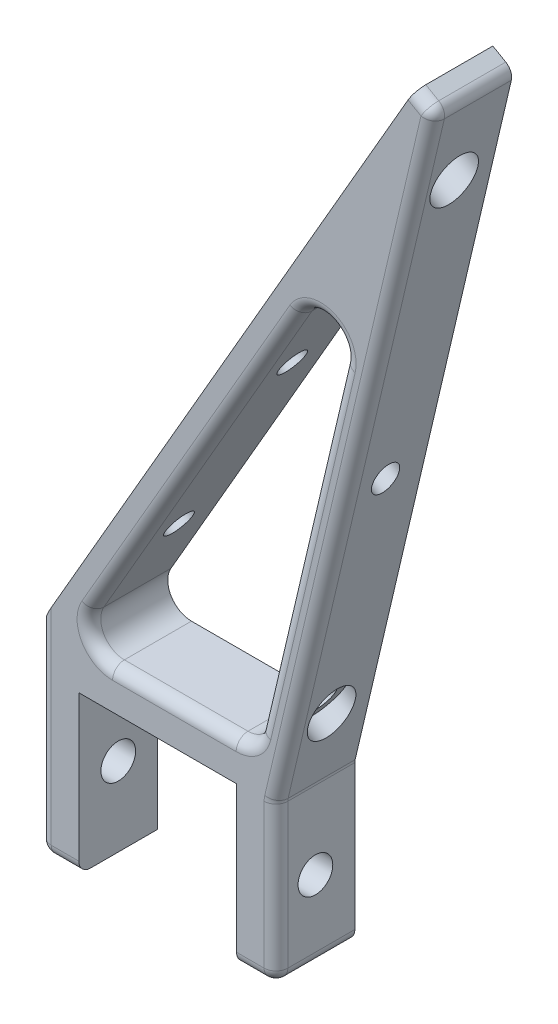
from build123d import *

# Parameters (mm, degrees)
BOSS_EXTRUDE1_DEPTH = 10
CUT_EXTRUDE1_DEPTH  = 95.596978287
FILLET1_R           = 3
FILLET2_R           = 1.5
SKETCH3_R           = 2.2
CUT_EXTRUDE2_DEPTH  = 102.020680113
SKETCH4_R           = 1.75
CUT_EXTRUDE3_DEPTH  = 94.58236857
CUT_EXTRUDE4_START  = 3
SKETCH5_R           = 3
CUT_EXTRUDE4_DEPTH  = 91.712514751
CUT_EXTRUDE5_START  = -24.38
SKETCH6_R           = 3
CUT_EXTRUDE5_DEPTH  = 70.20236857


with BuildPart() as part:
    # Sketch1 → Boss-Extrude1 (new body)
    with BuildSketch(Plane.XY):
        Polygon((-10, -20), (-10, 0), (10, 0), (10, -20), (15, -20), (15, 0), (35.101483834, 85.770445967), (32.5, 87.27241336), (-15, 5), (-15, -20), align=None)
    extrude(amount=BOSS_EXTRUDE1_DEPTH)

    # Sketch2 → Cut-Extrude1 (cut, through all)
    with BuildSketch(Plane.XY.offset(10)):
        Polygon((-10.917498512, 5), (28.214788811, 72.779109859), (12.329822075, 5), align=None)
    extrude(amount=-CUT_EXTRUDE1_DEPTH, mode=Mode.SUBTRACT)

    # Fillet1
    fillet1_edges = [part.edges().sort_by_distance(p)[0] for p in [
        (28.214788811, 72.779109859, 5),
        (12.329822075, 5, 5),
        (-10.917498512, 5, 5),
    ]]
    fillet(fillet1_edges, radius=FILLET1_R)

    # Fillet2
    fillet2_edges = [part.edges().sort_by_distance(p)[0] for p in [
        (12.5, -20, 10),
        (-15, -20, 5),
        (35.101483834, 85.770445967, 5),
        (15, 0, 5),
        (15, -20, 5),
        (15, -10, 10),
        (25.050741917, 42.885222984, 10),
        (33.800741917, 86.521429663, 10),
        (-15, -7.5, 10),
        (-12.5, -20, 10),
        (4.871758353, 32.347795103, 10),
        (18.227176379, 30.163252268, 10),
        (2.115139497, 5, 10),
        (21.765145456, 56.485016027, 10),
        (11.815273588, 5.649082253, 10),
        (-8.3194223, 6.5, 10),
    ]]
    fillet(fillet2_edges, radius=FILLET2_R)

    # Sketch3 → Cut-Extrude2 (cut, through all)
    with BuildSketch(Plane.ZY.offset(15)):
        with Locations(Location((5, -10, 0), (0, 0, 270))):
            Circle(SKETCH3_R)
    extrude(amount=-CUT_EXTRUDE2_DEPTH, mode=Mode.SUBTRACT)

    # Sketch4 → Cut-Extrude3 (cut, through all)
    with BuildSketch(Plane(origin=(-13.415063509, 7.745190528, 0), x_dir=(0, 0, 1), z_dir=(-0.8660254037844382, 0.500000000000001, 0))):
        with Locations(Location((5, 81.330127019, 0), (0, 0, 270))):
            Circle(SKETCH4_R)
        with Locations(Location((5, 44.830127019, 0), (0, 0, 270))):
            Circle(SKETCH4_R)
        with Locations(Location((5, 16.098937019, 0), (0, 0, 270))):
            Circle(SKETCH4_R)
    extrude(amount=-CUT_EXTRUDE3_DEPTH, mode=Mode.SUBTRACT)

    # Sketch5 → Cut-Extrude4 (cut, through all)
    with BuildSketch(Plane(origin=(-13.480526942, 7.631804537, 0), x_dir=(0, 0, -1), z_dir=(0.866025403784438, -0.5000000000000009, 0)).offset(CUT_EXTRUDE4_START)):
        with Locations(Location((-5, 81.461053884, 0), (0, 0, 90))):
            Circle(SKETCH5_R)
    extrude(amount=CUT_EXTRUDE4_DEPTH, mode=Mode.SUBTRACT)

    # Sketch6 → Cut-Extrude5 (cut, through all)
    with BuildSketch(Plane(origin=(-13.415063509, 7.745190528, 0), x_dir=(0, 0, 1), z_dir=(-0.8660254037844382, 0.500000000000001, 0)).offset(CUT_EXTRUDE5_START)):
        with Locations(Location((5, 16.098937019, 0), (0, 0, 270))):
            Circle(SKETCH6_R)
    extrude(amount=-CUT_EXTRUDE5_DEPTH, mode=Mode.SUBTRACT)


solid = part.part
